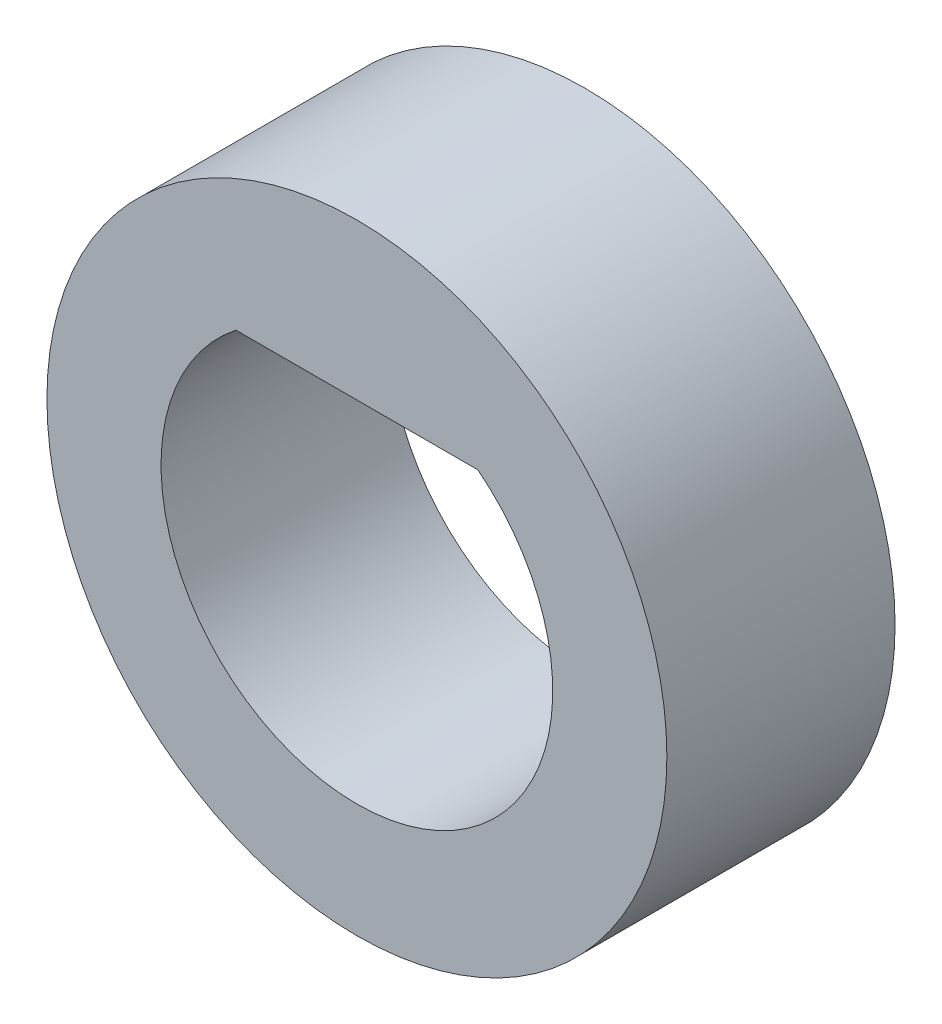
from build123d import *

# Parameters (mm, degrees)
SKETCH1_R           = 4.075
BOSS_EXTRUDE1_DEPTH = 3


with BuildPart() as part:
    # Sketch1 → Boss-Extrude1 (new body)
    with BuildSketch(Plane.XY):
        Circle(SKETCH1_R)
        with BuildLine():
            Line((-1.590597372, 2.025), (1.590597372, 2.025))
            ThreePointArc((1.590597372, 2.025), (0, -2.575), (-1.590597372, 2.025))
        make_face(mode=Mode.SUBTRACT)
    extrude(amount=BOSS_EXTRUDE1_DEPTH)


solid = part.part
